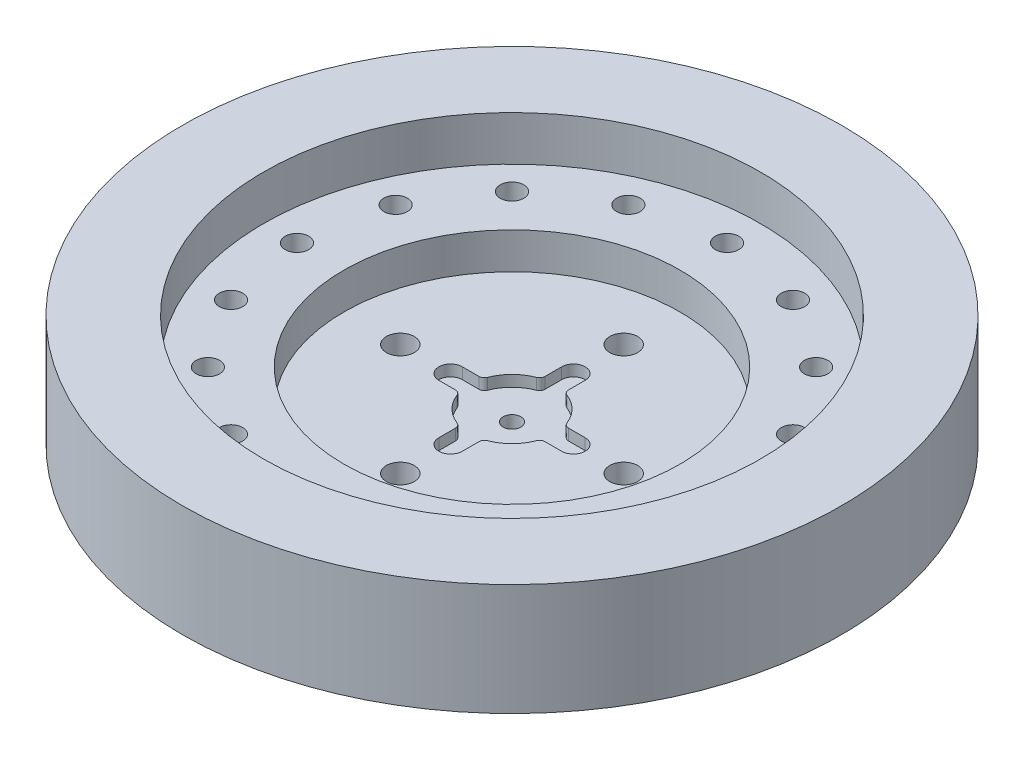
from build123d import *

# Parameters (mm, degrees)
SKETCH_1_R           = 59
EXTRUDE_1_DEPTH      = 20
SKETCH_2_R           = 44.5
CUT_EXTRUDE_1_DEPTH  = 8
SKETCH_3_R           = 30.1
CUT_EXTRUDE_2_DEPTH  = 6.5
SKETCH_4_R           = 2.1
CUT_EXTRUDE_3_DEPTH  = 86.802097876
SKETCH_5_R           = 3.75
CUT_EXTRUDE_4_DEPTH  = 5
M6X1_0_2_D           = 5
SKETCH_26_R          = 3.1
CUT_EXTRUDE_14_DEPTH = 1.2
CUT_EXTRUDE_17_DEPTH = 2
FILLET_1_R           = 1
SKETCH_29_R          = 1.6
CUT_EXTRUDE_18_DEPTH = 86.530345492


with BuildPart() as part:
    # 草图1 → 凸台-拉伸1 (new body)
    with BuildSketch(Plane(origin=(0, 0, 0), x_dir=(1, 0, 0), z_dir=(0, 1, 0))):
        with Locations(Location((0, 0, 0), (0, 0, 270))):
            Circle(SKETCH_1_R)
    extrude(amount=EXTRUDE_1_DEPTH)

    # 草图2 → 切除-拉伸1 (cut)
    with BuildSketch(Plane(origin=(0, 20, 0), x_dir=(1, 0, 0), z_dir=(0, 1, 0))):
        with Locations(Location((0, 0, 0), (0, 0, 270))):
            Circle(SKETCH_2_R)
    extrude(amount=-CUT_EXTRUDE_1_DEPTH, mode=Mode.SUBTRACT)

    # 草图3 → 切除-拉伸2 (cut)
    with BuildSketch(Plane(origin=(0, 12, 0), x_dir=(1, 0, 0), z_dir=(0, 1, 0))):
        with Locations(Location((0, 0, 0), (0, 0, 270))):
            Circle(SKETCH_3_R)
    extrude(amount=-CUT_EXTRUDE_2_DEPTH, mode=Mode.SUBTRACT)

    # 草图4 → 切除-拉伸3 (cut, through all)
    with BuildSketch(Plane.XZ):
        with Locations(Location((0, 38.5, 0), (0, 0, 270))):
            Circle(SKETCH_4_R)
        with Locations(Location((14.733312146, 35.569362002, 0), (0, 0, 270))):
            Circle(SKETCH_4_R)
        with Locations(Location((27.223611076, 27.223611076, 0), (0, 0, 270))):
            Circle(SKETCH_4_R)
        with Locations(Location((35.569362002, 14.733312146, 0), (0, 0, 270))):
            Circle(SKETCH_4_R)
        with Locations(Location((38.5, 0, 0), (0, 0, 270))):
            Circle(SKETCH_4_R)
        with Locations(Location((35.569362002, -14.733312146, 0), (0, 0, 270))):
            Circle(SKETCH_4_R)
        with Locations(Location((27.223611076, -27.223611076, 0), (0, 0, 270))):
            Circle(SKETCH_4_R)
        with Locations(Location((14.733312146, -35.569362002, 0), (0, 0, 270))):
            Circle(SKETCH_4_R)
        with Locations(Location((0, -38.5, 0), (0, 0, 270))):
            Circle(SKETCH_4_R)
        with Locations(Location((-14.733312146, -35.569362002, 0), (0, 0, 270))):
            Circle(SKETCH_4_R)
        with Locations(Location((-27.223611076, -27.223611076, 0), (0, 0, 270))):
            Circle(SKETCH_4_R)
        with Locations(Location((-35.569362002, -14.733312146, 0), (0, 0, 270))):
            Circle(SKETCH_4_R)
        with Locations(Location((-38.5, 0, 0), (0, 0, 270))):
            Circle(SKETCH_4_R)
        with Locations(Location((-35.569362002, 14.733312146, 0), (0, 0, 270))):
            Circle(SKETCH_4_R)
        with Locations(Location((-27.223611076, 27.223611076, 0), (0, 0, 270))):
            Circle(SKETCH_4_R)
        with Locations(Location((-14.733312146, 35.569362002, 0), (0, 0, 270))):
            Circle(SKETCH_4_R)
    extrude(amount=-CUT_EXTRUDE_3_DEPTH, mode=Mode.SUBTRACT)

    # 草图5 → 切除-拉伸4 (cut)
    with BuildSketch(Plane.XZ):
        with Locations(Location((0, 38.5, 0), (0, 0, 270))):
            Circle(SKETCH_5_R)
        with Locations(Location((14.733312146, 35.569362002, 0), (0, 0, 270))):
            Circle(SKETCH_5_R)
        with Locations(Location((27.223611076, 27.223611076, 0), (0, 0, 270))):
            Circle(SKETCH_5_R)
        with Locations(Location((35.569362002, 14.733312146, 0), (0, 0, 270))):
            Circle(SKETCH_5_R)
        with Locations(Location((38.5, 0, 0), (0, 0, 270))):
            Circle(SKETCH_5_R)
        with Locations(Location((35.569362002, -14.733312146, 0), (0, 0, 270))):
            Circle(SKETCH_5_R)
        with Locations(Location((27.223611076, -27.223611076, 0), (0, 0, 270))):
            Circle(SKETCH_5_R)
        with Locations(Location((14.733312146, -35.569362002, 0), (0, 0, 270))):
            Circle(SKETCH_5_R)
        with Locations(Location((0, -38.5, 0), (0, 0, 270))):
            Circle(SKETCH_5_R)
        with Locations(Location((-14.733312146, -35.569362002, 0), (0, 0, 270))):
            Circle(SKETCH_5_R)
        with Locations(Location((-27.223611076, -27.223611076, 0), (0, 0, 270))):
            Circle(SKETCH_5_R)
        with Locations(Location((-35.569362002, -14.733312146, 0), (0, 0, 270))):
            Circle(SKETCH_5_R)
        with Locations(Location((-38.5, 0, 0), (0, 0, 270))):
            Circle(SKETCH_5_R)
        with Locations(Location((-35.569362002, 14.733312146, 0), (0, 0, 270))):
            Circle(SKETCH_5_R)
        with Locations(Location((-27.223611076, 27.223611076, 0), (0, 0, 270))):
            Circle(SKETCH_5_R)
        with Locations(Location((-14.733312146, 35.569362002, 0), (0, 0, 270))):
            Circle(SKETCH_5_R)
    extrude(amount=-CUT_EXTRUDE_4_DEPTH, mode=Mode.SUBTRACT)

    # M6x1.0 螺纹孔2 (through all)
    with Locations(Plane(origin=(0, 0, 0), x_dir=(-1, 0, 0), z_dir=(0, -1, 0))):
        with Locations((0, 20), (-20, 0), (0, -20), (20, 0)):
            Hole(M6X1_0_2_D / 2)

    # 草图26 → 切除-拉伸14 (cut)
    with BuildSketch(Plane.XZ):
        with Locations(Location((0, 0, 0), (0, 0, 270))):
            Circle(SKETCH_26_R)
    extrude(amount=-CUT_EXTRUDE_14_DEPTH, mode=Mode.SUBTRACT)

    # 草图28 → 切除-拉伸17 (cut)
    with BuildSketch(Plane(origin=(0, 5.5, 0), x_dir=(1, 0, 0), z_dir=(0, 1, 0))):
        with BuildLine():
            Line((-2.1, 11), (-2.1, 7.304108433))
            ThreePointArc((-2.1, 7.304108433), (0, 7.6), (2.1, 7.304108433))
            Line((2.1, 7.304108433), (2.1, 11))
            ThreePointArc((2.1, 11), (0, 13.1), (-2.1, 11))
        make_face()
        with BuildLine():
            ThreePointArc((2.1, 5), (0, 2.9), (-2.1, 5))
            Line((-2.1, 5), (-2.1, 7.304108433))
            ThreePointArc((-2.1, 7.304108433), (-5.374011537, 5.374011537), (-7.304108433, 2.1))
            Line((-7.304108433, 2.1), (-5, 2.1))
            ThreePointArc((-5, 2.1), (-2.9, 0), (-5, -2.1))
            Line((-5, -2.1), (-7.304108433, -2.1))
            ThreePointArc((-7.304108433, -2.1), (-5.374011537, -5.374011537), (-2.1, -7.304108433))
            Line((-2.1, -7.304108433), (-2.1, -5))
            ThreePointArc((-2.1, -5), (0, -2.9), (2.1, -5))
            Line((2.1, -5), (2.1, -7.304108433))
            ThreePointArc((2.1, -7.304108433), (5.374011537, -5.374011537), (7.304108433, -2.1))
            Line((7.304108433, -2.1), (5, -2.1))
            ThreePointArc((5, -2.1), (2.9, 0), (5, 2.1))
            Line((5, 2.1), (7.304108433, 2.1))
            ThreePointArc((7.304108433, 2.1), (5.374011537, 5.374011537), (2.1, 7.304108433))
            Line((2.1, 7.304108433), (2.1, 5))
        make_face()
        with BuildLine():
            ThreePointArc((-7.304108433, -2.1), (-7.6, 0), (-7.304108433, 2.1))
            Line((-7.304108433, 2.1), (-11, 2.1))
            ThreePointArc((-11, 2.1), (-13.1, 0), (-11, -2.1))
            Line((-11, -2.1), (-7.304108433, -2.1))
        make_face()
        with BuildLine():
            ThreePointArc((2.1, -7.304108433), (0, -7.6), (-2.1, -7.304108433))
            Line((-2.1, -7.304108433), (-2.1, -11))
            ThreePointArc((-2.1, -11), (0, -13.1), (2.1, -11))
            Line((2.1, -11), (2.1, -7.304108433))
        make_face()
        with BuildLine():
            Line((11, 2.1), (7.304108433, 2.1))
            ThreePointArc((7.304108433, 2.1), (7.525663562, 1.060371612), (7.6, 0))
            ThreePointArc((7.6, 0), (7.525663562, -1.060371612), (7.304108433, -2.1))
            Line((7.304108433, -2.1), (11, -2.1))
            ThreePointArc((11, -2.1), (13.1, 0), (11, 2.1))
        make_face()
        with BuildLine():
            Line((-2.1, 7.304108433), (-2.1, 5))
            ThreePointArc((-2.1, 5), (0, 2.9), (2.1, 5))
            Line((2.1, 5), (2.1, 7.304108433))
            ThreePointArc((2.1, 7.304108433), (0, 7.6), (-2.1, 7.304108433))
        make_face()
        with BuildLine():
            Line((-5, 2.1), (-7.304108433, 2.1))
            ThreePointArc((-7.304108433, 2.1), (-7.6, 0), (-7.304108433, -2.1))
            Line((-7.304108433, -2.1), (-5, -2.1))
            ThreePointArc((-5, -2.1), (-2.9, 0), (-5, 2.1))
        make_face()
        with BuildLine():
            ThreePointArc((7.6, 0), (7.525663562, 1.060371612), (7.304108433, 2.1))
            Line((7.304108433, 2.1), (5, 2.1))
            ThreePointArc((5, 2.1), (2.9, 0), (5, -2.1))
            Line((5, -2.1), (7.304108433, -2.1))
            ThreePointArc((7.304108433, -2.1), (7.525663562, -1.060371612), (7.6, 0))
        make_face()
        with BuildLine():
            Line((-2.1, -5), (-2.1, -7.304108433))
            ThreePointArc((-2.1, -7.304108433), (0, -7.6), (2.1, -7.304108433))
            Line((2.1, -7.304108433), (2.1, -5))
            ThreePointArc((2.1, -5), (0, -2.9), (-2.1, -5))
        make_face()
    extrude(amount=-CUT_EXTRUDE_17_DEPTH, mode=Mode.SUBTRACT)

    # 圆角1
    fillet_1_edges = [part.edges().sort_by_distance(p)[0] for p in [
        (-7.304108433, 4.5, -2.1),
        (-2.1, 4.5, -7.304108433),
        (2.1, 4.5, -7.304108433),
        (7.304108433, 4.5, -2.1),
        (7.304108433, 4.5, 2.1),
        (2.1, 4.5, 7.304108433),
        (-2.1, 4.5, 7.304108433),
        (-7.304108433, 4.5, 2.1),
    ]]
    fillet(fillet_1_edges, radius=FILLET_1_R)

    # 草图29 → 切除-拉伸18 (cut, through all)
    with BuildSketch(Plane.XZ.offset(-1.2)):
        with Locations(Location((0, 0, 0), (0, 0, 270))):
            Circle(SKETCH_29_R)
    extrude(amount=-CUT_EXTRUDE_18_DEPTH, mode=Mode.SUBTRACT)


solid = part.part
